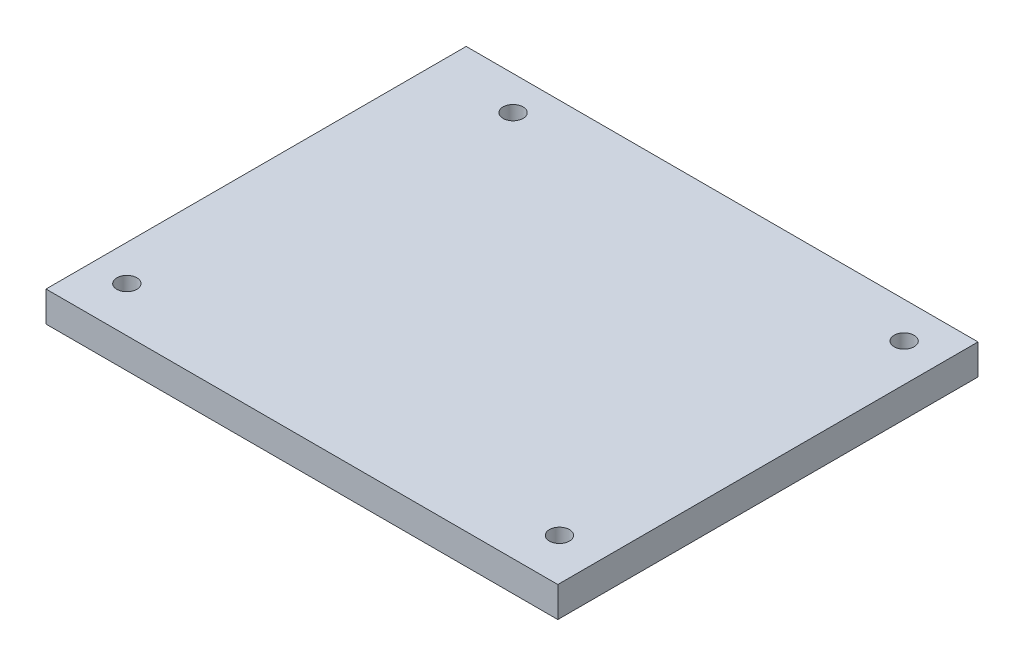
from build123d import *

# Parameters (mm, degrees)
SKETCH1_W           = 101.1
SKETCH1_H           = 83
SKETCH1_R           = 1.98
BOSS_EXTRUDE1_DEPTH = 6


with BuildPart() as part:
    # Sketch1 → Boss-Extrude1 (new body)
    with BuildSketch(Plane(origin=(0, 0, 0), x_dir=(1, 0, 0), z_dir=(0, 1, 0))):
        Rectangle(SKETCH1_W, SKETCH1_H)
        with Locations(Location((43.1, 34.36, 0), (0, 0, 270))):
            Circle(SKETCH1_R, mode=Mode.SUBTRACT)
        with Locations(Location((-34.59, 34.8, 0), (0, 0, 270))):
            Circle(SKETCH1_R, mode=Mode.SUBTRACT)
        with Locations(Location((42.3, -32.93, 0), (0, 0, 270))):
            Circle(SKETCH1_R, mode=Mode.SUBTRACT)
        with Locations(Location((-43.5, -32.58, 0), (0, 0, 270))):
            Circle(SKETCH1_R, mode=Mode.SUBTRACT)
    extrude(amount=BOSS_EXTRUDE1_DEPTH)


solid = part.part
